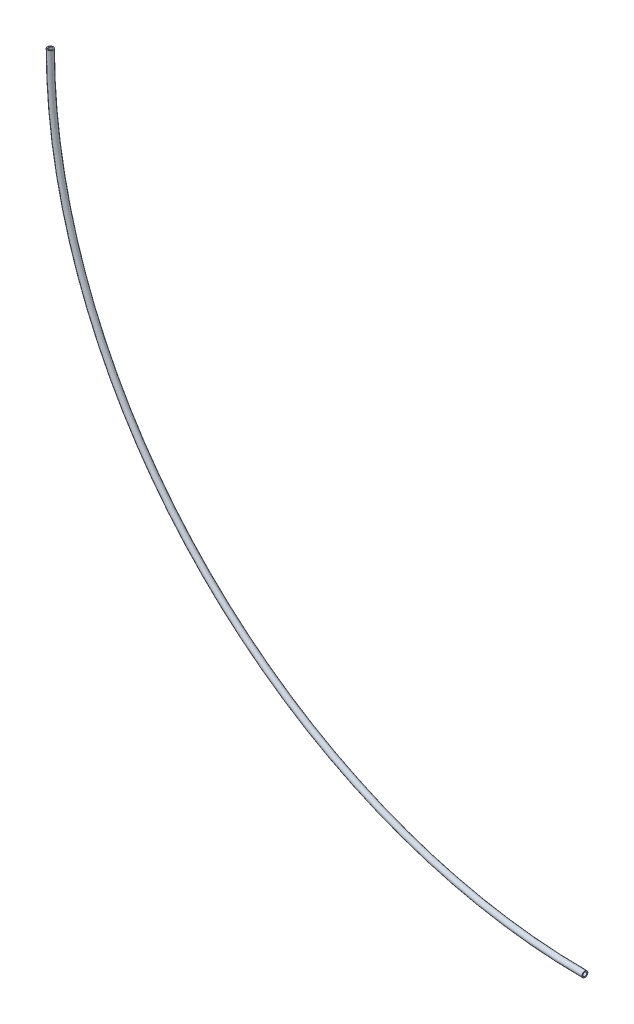
from build123d import *

# Parameters (mm, degrees)
SWEEP_1_PROFILE_R   = 6
SWEEP_1_PROFILE_R_2 = 4


with BuildPart() as part:
    # 扫描-薄件1: sweep along a path in 草图1
    with BuildLine(Plane.XY) as sweep_1_path:
        ThreePointArc((-1100, 0), (-777.817459305, -777.817459305), (0, -1100))
    # 扫描-薄件1 profile (on start of the path) → 扫描-薄件1 (sweep)
    with BuildSketch(Plane(origin=(-1100, 0, 0), x_dir=(-1, 0, 0), z_dir=(0, -1, 0))):
        Circle(SWEEP_1_PROFILE_R)
        Circle(SWEEP_1_PROFILE_R_2, mode=Mode.SUBTRACT)
    sweep(path=sweep_1_path.line)


solid = part.part
